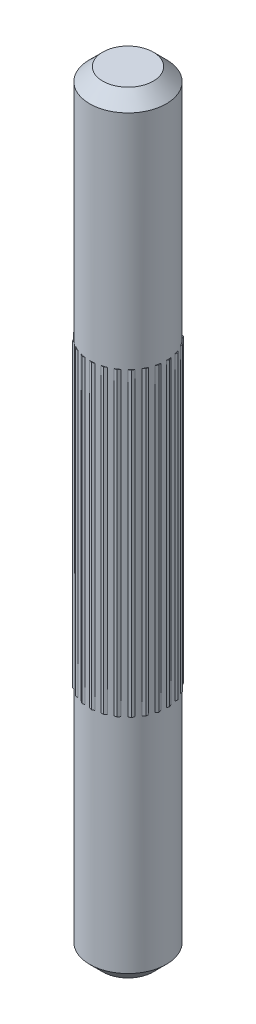
from build123d import *
from build123d.topology import SkipClean

# Parameters (mm, degrees)
SKETCH1_R      = 1.465
EXTRUDE1_DEPTH = 14.75
CHAMFER1_SIZE  = 0.5
EXTRUDE2_DEPTH = 5.75


with BuildPart() as part:
    # Sketch1 → Extrude1 (new, symmetric)
    with BuildSketch(Plane(origin=(0, 0, 0), x_dir=(1, 0, 0), z_dir=(0, 1, 0))):
        with Locations(Location((0, 0, 0), (0, 0, 270))):
            Circle(SKETCH1_R)
    extrude(amount=EXTRUDE1_DEPTH, both=True)

    # Chamfer1
    chamfer1_edges = [part.edges().sort_by_distance(p)[0] for p in [
        (0, -14.75, -1.465),
        (0, 14.75, -1.465),
    ]]
    chamfer(chamfer1_edges, length=CHAMFER1_SIZE)

    # Sketch2 → Extrude2 (add, symmetric)
    with SkipClean():  # the faces are left unmerged after this step: merging them gives an invalid solid
        with BuildSketch(Plane(origin=(0, 0, 0), x_dir=(1, 0, 0), z_dir=(0, 1, 0))):
            with BuildLine():
                Line((0.191220872, 1.452466722), (0.292635483, 1.471177921))
                Line((0.292635483, 1.471177921), (0.379169901, 1.415081336))
                ThreePointArc((0.379169901, 1.415081336), (0.470908817, 1.38725264), (0.560631228, 1.353483515))
                Line((0.560631228, 1.353483515), (0.663433035, 1.345309112))
                Line((0.663433035, 1.345309112), (0.7325, 1.268727217))
                ThreePointArc((0.7325, 1.268727217), (0.813910391, 1.218102982), (0.891835493, 1.162262644))
                Line((0.891835493, 1.162262644), (0.989018723, 1.127759711))
                Line((0.989018723, 1.127759711), (1.035911434, 1.035911434))
                ThreePointArc((1.035911434, 1.035911434), (1.101445318, 0.965941619), (1.162262644, 0.891835493))
                Line((1.162262644, 0.891835493), (1.247204418, 0.83335535))
                Line((1.247204418, 0.83335535), (1.268727217, 0.7325))
                ThreePointArc((1.268727217, 0.7325), (1.313918566, 0.647952931), (1.353483515, 0.560631228))
                Line((1.353483515, 0.560631228), (1.420395194, 0.482159198))
                Line((1.420395194, 0.482159198), (1.415081336, 0.379169901))
                ThreePointArc((1.415081336, 0.379169901), (1.436850436, 0.285807322), (1.452466722, 0.191220872))
                Line((1.452466722, 0.191220872), (1.496788385, 0.098104694))
                Line((1.496788385, 0.098104694), (1.465, 0))
                ThreePointArc((1.465, 0), (1.461863323, -0.095815584), (1.452466722, -0.191220872))
                Line((1.452466722, -0.191220872), (1.471177921, -0.292635483))
                Line((1.471177921, -0.292635483), (1.415081336, -0.379169901))
                ThreePointArc((1.415081336, -0.379169901), (1.38725264, -0.470908817), (1.353483515, -0.560631228))
                Line((1.353483515, -0.560631228), (1.345309112, -0.663433035))
                Line((1.345309112, -0.663433035), (1.268727217, -0.7325))
                ThreePointArc((1.268727217, -0.7325), (1.218102982, -0.813910391), (1.162262644, -0.891835493))
                Line((1.162262644, -0.891835493), (1.127759711, -0.989018723))
                Line((1.127759711, -0.989018723), (1.035911434, -1.035911434))
                ThreePointArc((1.035911434, -1.035911434), (0.965941619, -1.101445318), (0.891835493, -1.162262644))
                Line((0.891835493, -1.162262644), (0.83335535, -1.247204418))
                Line((0.83335535, -1.247204418), (0.7325, -1.268727217))
                ThreePointArc((0.7325, -1.268727217), (0.647952931, -1.313918566), (0.560631228, -1.353483515))
                Line((0.560631228, -1.353483515), (0.482159198, -1.420395194))
                Line((0.482159198, -1.420395194), (0.379169901, -1.415081336))
                ThreePointArc((0.379169901, -1.415081336), (0.285807322, -1.436850436), (0.191220872, -1.452466722))
                Line((0.191220872, -1.452466722), (0.098104694, -1.496788385))
                Line((0.098104694, -1.496788385), (0, -1.465))
                ThreePointArc((0, -1.465), (-0.095815584, -1.461863323), (-0.191220872, -1.452466722))
                Line((-0.191220872, -1.452466722), (-0.292635483, -1.471177921))
                Line((-0.292635483, -1.471177921), (-0.379169901, -1.415081336))
                ThreePointArc((-0.379169901, -1.415081336), (-0.470908817, -1.38725264), (-0.560631228, -1.353483515))
                Line((-0.560631228, -1.353483515), (-0.663433035, -1.345309112))
                Line((-0.663433035, -1.345309112), (-0.7325, -1.268727217))
                ThreePointArc((-0.7325, -1.268727217), (-0.813910391, -1.218102982), (-0.891835493, -1.162262644))
                Line((-0.891835493, -1.162262644), (-0.989018723, -1.127759711))
                Line((-0.989018723, -1.127759711), (-1.035911434, -1.035911434))
                ThreePointArc((-1.035911434, -1.035911434), (-1.101445318, -0.965941619), (-1.162262644, -0.891835493))
                Line((-1.162262644, -0.891835493), (-1.247204418, -0.83335535))
                Line((-1.247204418, -0.83335535), (-1.268727217, -0.7325))
                ThreePointArc((-1.268727217, -0.7325), (-1.313918566, -0.647952931), (-1.353483515, -0.560631228))
                Line((-1.353483515, -0.560631228), (-1.420395194, -0.482159198))
                Line((-1.420395194, -0.482159198), (-1.415081336, -0.379169901))
                ThreePointArc((-1.415081336, -0.379169901), (-1.436850436, -0.285807322), (-1.452466722, -0.191220872))
                Line((-1.452466722, -0.191220872), (-1.496788385, -0.098104694))
                Line((-1.496788385, -0.098104694), (-1.465, 0))
                ThreePointArc((-1.465, 0), (-1.461863323, 0.095815584), (-1.452466722, 0.191220872))
                Line((-1.452466722, 0.191220872), (-1.471177921, 0.292635483))
                Line((-1.471177921, 0.292635483), (-1.415081336, 0.379169901))
                ThreePointArc((-1.415081336, 0.379169901), (-1.38725264, 0.470908817), (-1.353483515, 0.560631228))
                Line((-1.353483515, 0.560631228), (-1.345309112, 0.663433035))
                Line((-1.345309112, 0.663433035), (-1.268727217, 0.7325))
                ThreePointArc((-1.268727217, 0.7325), (-1.218102982, 0.813910391), (-1.162262644, 0.891835493))
                Line((-1.162262644, 0.891835493), (-1.127759711, 0.989018723))
                Line((-1.127759711, 0.989018723), (-1.035911434, 1.035911434))
                ThreePointArc((-1.035911434, 1.035911434), (-0.965941619, 1.101445318), (-0.891835493, 1.162262644))
                Line((-0.891835493, 1.162262644), (-0.83335535, 1.247204418))
                Line((-0.83335535, 1.247204418), (-0.7325, 1.268727217))
                ThreePointArc((-0.7325, 1.268727217), (-0.647952931, 1.313918566), (-0.560631228, 1.353483515))
                Line((-0.560631228, 1.353483515), (-0.482159198, 1.420395194))
                Line((-0.482159198, 1.420395194), (-0.379169901, 1.415081336))
                ThreePointArc((-0.379169901, 1.415081336), (-0.285807322, 1.436850436), (-0.191220872, 1.452466722))
                Line((-0.191220872, 1.452466722), (-0.098104694, 1.496788385))
                Line((-0.098104694, 1.496788385), (0, 1.465))
                ThreePointArc((0, 1.465), (0.095815584, 1.461863323), (0.191220872, 1.452466722))
            make_face()
        extrude(amount=EXTRUDE2_DEPTH, both=True)


solid = part.part
